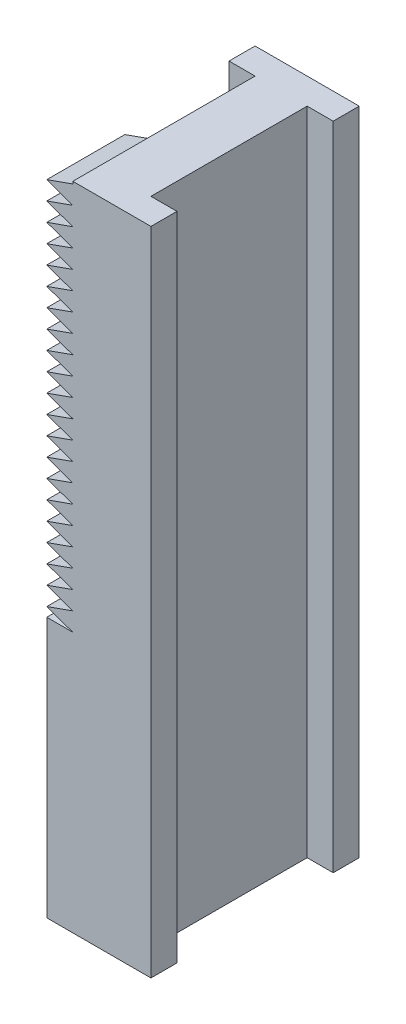
from build123d import *

# Parameters (mm, degrees)
BOSS_EXTRUDE1_DEPTH = 25
SKETCH2_W           = 1
SKETCH2_H           = 1
CUT_EXTRUDE1_DEPTH  = 15
BOSS_EXTRUDE2_DEPTH = 3
LPATTERN1_COUNT     = 21
LPATTERN1_PITCH     = 0.71


with BuildPart() as part:
    # Sketch1 → Boss-Extrude1 (new body)
    with BuildSketch(Plane(origin=(0, 0, 0), x_dir=(1, 0, 0), z_dir=(0, 1, 0))):
        Polygon((2, 4), (-2, 4), (-2, 3), (-1, 3), (-1, 0), (1, 0), (1, 3), (2, 3), align=None)
    boss_extrude1 = extrude(amount=BOSS_EXTRUDE1_DEPTH)

    # Mirror1: Boss-Extrude1 across plane
    add(boss_extrude1.mirror(Plane(origin=(-1, 25, 0), x_dir=(1, 0, 0), z_dir=(0, 0, -1))))

    # Sketch2 → Cut-Extrude1 (cut)
    with BuildSketch(Plane(origin=(0, 25, 0), x_dir=(1, 0, 0), z_dir=(0, 1, 0))):
        with Locations((-1.5, -3.5)):
            Rectangle(SKETCH2_W, SKETCH2_H)
    extrude(amount=-CUT_EXTRUDE1_DEPTH, mode=Mode.SUBTRACT)

    # Sketch3 → Boss-Extrude2 (add)
    with BuildSketch(Plane.XY.offset(4)):
        Polygon((-1, 10), (-2, 10.355), (-1, 10.71), align=None)
    boss_extrude2 = extrude(amount=-BOSS_EXTRUDE2_DEPTH)

    # LPattern1: Boss-Extrude2 ×21
    with Locations(*[(0, i * LPATTERN1_PITCH, 0) for i in range(1, LPATTERN1_COUNT)]):
        add(boss_extrude2)


solid = part.part
